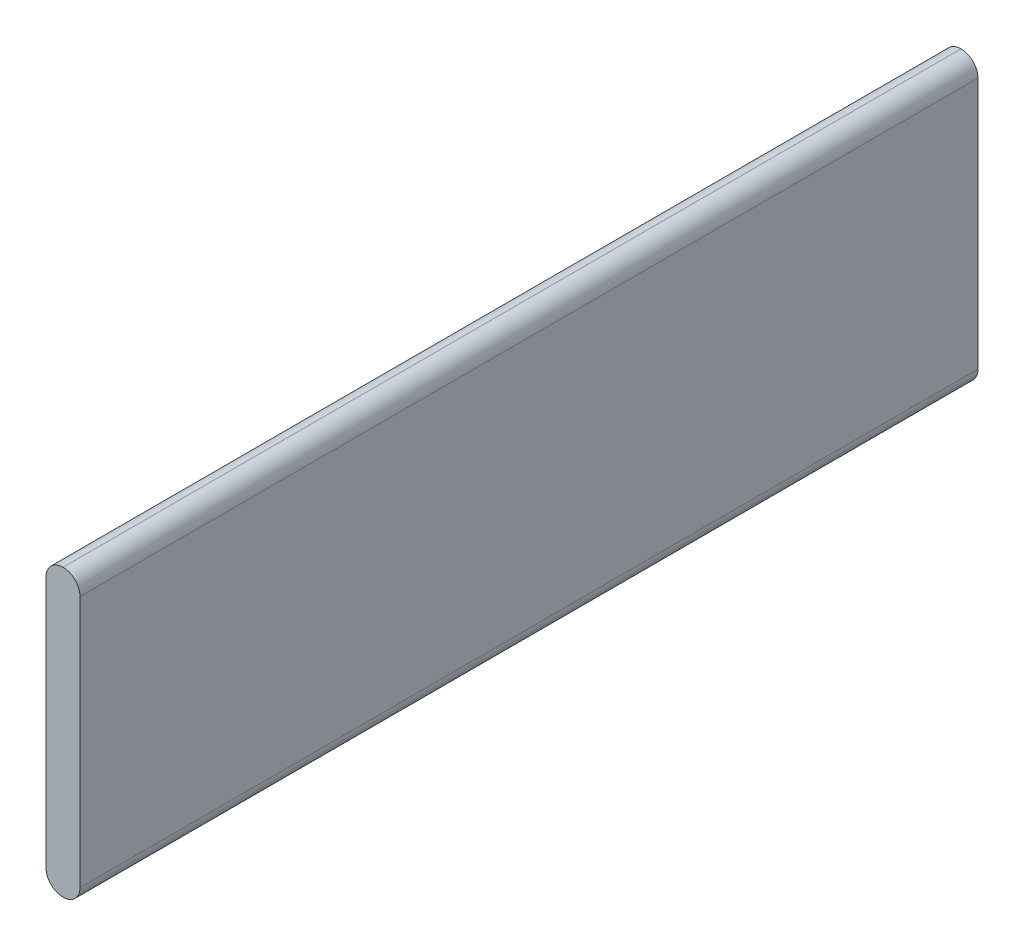
from build123d import *

# Parameters (mm, degrees)
EXTRUSION1_DEPTH = 66


with BuildPart() as part:
    # Esquisse1 → Extrusion1 (new body)
    with BuildSketch(Plane.XY):
        with BuildLine():
            Line((-9.981674736, 18.916969353), (-9.961674736, 18.916969353))
            ThreePointArc((-9.961674736, 18.916969353), (-9.084862327, 18.553781762), (-8.721674736, 17.676969353))
            Line((-8.721674736, 17.676969353), (-8.721674736, -0.843030647))
            ThreePointArc((-8.721674736, -0.843030647), (-9.084862327, -1.719843056), (-9.961674736, -2.083030647))
            Line((-9.961674736, -2.083030647), (-9.981674736, -2.083030647))
            ThreePointArc((-9.981674736, -2.083030647), (-10.858487145, -1.719843056), (-11.221674736, -0.843030647))
            Line((-11.221674736, -0.843030647), (-11.221674736, 17.676969353))
            ThreePointArc((-11.221674736, 17.676969353), (-10.858487145, 18.553781762), (-9.981674736, 18.916969353))
        make_face()
    extrude(amount=EXTRUSION1_DEPTH)


solid = part.part
